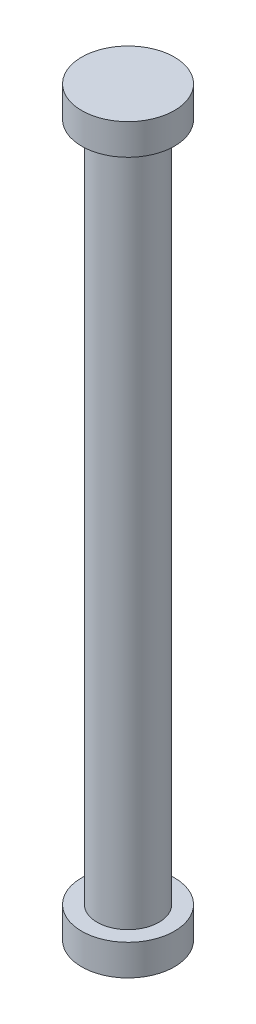
from build123d import *

# Parameters (mm, degrees)
SKETCH1_R           = 1
BOSS_EXTRUDE1_DEPTH = 22
SKETCH2_R           = 1.5
BOSS_EXTRUDE2_DEPTH = 1


with BuildPart() as part:
    # Sketch1 → Boss-Extrude1 (new body)
    with BuildSketch(Plane(origin=(0, 0, 0), x_dir=(1, 0, 0), z_dir=(0, 1, 0))):
        with Locations(Location((0, 0, 0), (0, 0, 270))):
            Circle(SKETCH1_R)
    extrude(amount=BOSS_EXTRUDE1_DEPTH)

    # Sketch2 → Boss-Extrude2 (add)
    with BuildSketch(Plane.XZ):
        with Locations(Location((0, 0, 0), (0, 0, 270))):
            Circle(SKETCH2_R)
    boss_extrude2 = extrude(amount=BOSS_EXTRUDE2_DEPTH)

    # Mirror2: Boss-Extrude2 across plane
    add(boss_extrude2.mirror(Plane.ZX.offset(11)))


solid = part.part
